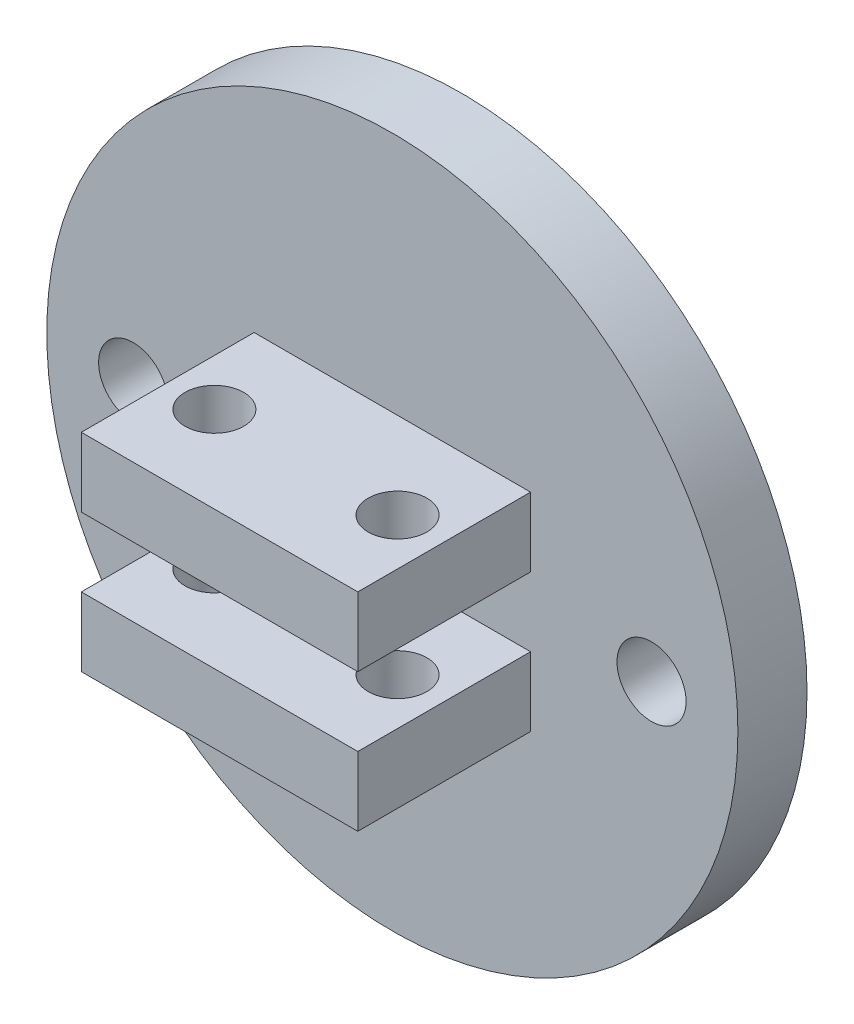
from build123d import *

# Parameters (mm, degrees)
CROQUIS1_R                               = 10
CROQUIS1_R_2                             = 1
SALIENTE_EXTRUIR1_DEPTH                  = 2
CROQUIS2_W                               = 8
CROQUIS2_H                               = 2
SALIENTE_EXTRUIR2_DEPTH                  = 5
TALADRO_DE_MARGEN_PARA_M1_61_D           = 1.7
TALADRO_DE_MARGEN_PARA_M1_61_CSINK_D     = 1.75
TALADRO_DE_MARGEN_PARA_M1_61_CSINK_ANGLE = 82


with BuildPart() as part:
    # Croquis1 → Saliente-Extruir1 (new body)
    with BuildSketch(Plane.XY):
        Circle(CROQUIS1_R)
        with Locations((-7.5, 0)):
            Circle(CROQUIS1_R_2, mode=Mode.SUBTRACT)
        with Locations((7.5, 0)):
            Circle(CROQUIS1_R_2, mode=Mode.SUBTRACT)
    extrude(amount=SALIENTE_EXTRUIR1_DEPTH)

    # Croquis2 → Saliente-Extruir2 (add)
    with BuildSketch(Plane.XY.offset(2)):
        with Locations((0, 2)):
            Rectangle(CROQUIS2_W, CROQUIS2_H)
        with Locations((0, -2)):
            Rectangle(CROQUIS2_W, CROQUIS2_H)
    extrude(amount=SALIENTE_EXTRUIR2_DEPTH)

    # Taladro de margen para M1.61 (through all)
    with Locations(Plane(origin=(0, -3, 0), x_dir=(-1, 0, 0), z_dir=(0, -1, 0))):
        with Locations((-2.65, -4.5), (2.65, -4.5)):
            CounterSinkHole(TALADRO_DE_MARGEN_PARA_M1_61_D / 2, TALADRO_DE_MARGEN_PARA_M1_61_CSINK_D / 2, counter_sink_angle=TALADRO_DE_MARGEN_PARA_M1_61_CSINK_ANGLE)


solid = part.part
